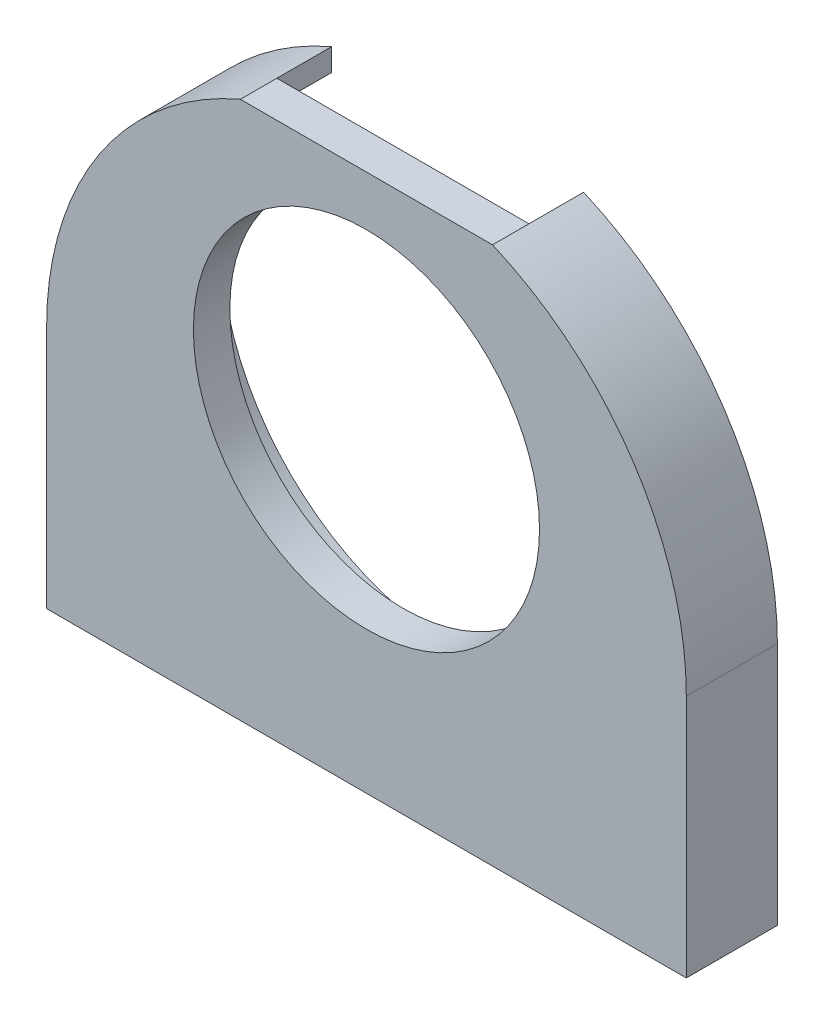
from build123d import *

# Parameters (mm, degrees)
BOSS_EXTRUDE1_DEPTH = 1.5
BOSS_EXTRUDE2_DEPTH = 1
SKETCH4_R           = 4.75
CUT_EXTRUDE1_DEPTH  = 23.898325822
SKETCH5_W           = 17.56
SKETCH5_H           = 2.5
BOSS_EXTRUDE3_DEPTH = 0.15


with BuildPart() as part:
    # Sketch1 → Boss-Extrude1 (new body)
    with BuildSketch(Plane.XY):
        with BuildLine():
            ThreePointArc((14.980604809, 6.55), (8.78, 2), (2.579395191, 6.55))
            Line((2.579395191, 6.55), (0, 6.55))
            Line((0, 6.55), (0, 0))
            Line((0, 0), (17.56, 0))
            Line((17.56, 0), (17.56, 6.55))
            Line((17.56, 6.55), (14.980604809, 6.55))
        make_face()
        with BuildLine():
            ThreePointArc((2.579395191, 6.55), (2.679421093, 10.743420825), (5.32, 14.002581212))
            Line((5.32, 14.002581212), (5.32, 14.619498126))
            ThreePointArc((5.32, 14.619498126), (1.449679407, 11.382680416), (0, 6.55))
            Line((0, 6.55), (2.579395191, 6.55))
        make_face()
        with BuildLine():
            ThreePointArc((12.24, 14.002581212), (14.880578907, 10.743420825), (14.980604809, 6.55))
            Line((14.980604809, 6.55), (17.56, 6.55))
            ThreePointArc((17.56, 6.55), (16.110320593, 11.382680416), (12.24, 14.619498126))
            Line((12.24, 14.619498126), (12.24, 14.002581212))
        make_face()
    extrude(amount=BOSS_EXTRUDE1_DEPTH)

    # Sketch3 → Boss-Extrude2 (add)
    with BuildSketch(Plane.XY.offset(1.5)):
        with BuildLine():
            Line((12.24, 14.619498126), (12.24, 14.002581212))
            ThreePointArc((12.24, 14.002581212), (8.78, 2), (5.32, 14.002581212))
            Line((5.32, 14.002581212), (5.32, 14.619498126))
            ThreePointArc((5.32, 14.619498126), (1.449679407, 11.382680416), (0, 6.55))
            Line((0, 6.55), (0, 0))
            Line((0, 0), (17.56, 0))
            Line((17.56, 0), (17.56, 6.55))
            ThreePointArc((17.56, 6.55), (16.110320593, 11.382680416), (12.24, 14.619498126))
        make_face()
        with BuildLine():
            Line((5.32, 14.619498126), (12.24, 14.619498126))
            Line((12.24, 14.619498126), (12.24, 14.002581212))
            ThreePointArc((12.24, 14.002581212), (8.78, 2), (5.32, 14.002581212))
            Line((5.32, 14.002581212), (5.32, 14.619498126))
        make_face()
    extrude(amount=BOSS_EXTRUDE2_DEPTH)

    # Sketch4 → Cut-Extrude1 (cut, through all)
    with BuildSketch(Plane(origin=(0, 0, 1.5), x_dir=(-1, 0, 0), z_dir=(0, 0, -1))):
        with Locations((-8.78, 8.5)):
            Circle(SKETCH4_R)
    extrude(amount=-CUT_EXTRUDE1_DEPTH, mode=Mode.SUBTRACT)

    # Sketch5 → Boss-Extrude3 (add)
    with BuildSketch(Plane.XZ):
        with Locations((8.78, 1.25)):
            Rectangle(SKETCH5_W, SKETCH5_H)
    extrude(amount=BOSS_EXTRUDE3_DEPTH)


solid = part.part
